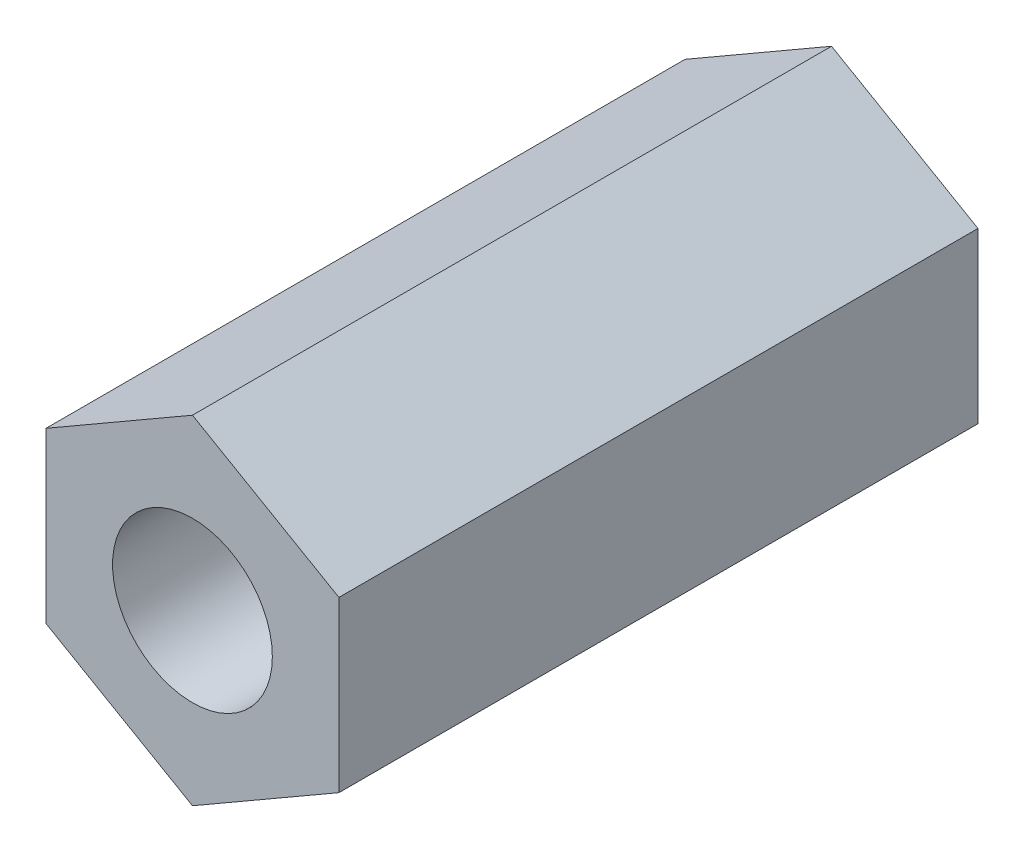
from build123d import *

# Parameters (mm, degrees)
SKETCH_1_R      = 1.5
EXTRUDE_1_DEPTH = 6


with BuildPart() as part:
    # Эскиз1 → Бобышка-Вытянуть1 (new, symmetric)
    with BuildSketch(Plane.XY):
        Polygon((2.75, 1.58771324), (0, 3.175426481), (-2.75, 1.58771324), (-2.75, -1.58771324), (0, -3.175426481), (2.75, -1.58771324), align=None)
        Circle(SKETCH_1_R, mode=Mode.SUBTRACT)
    extrude(amount=EXTRUDE_1_DEPTH, both=True)


solid = part.part
